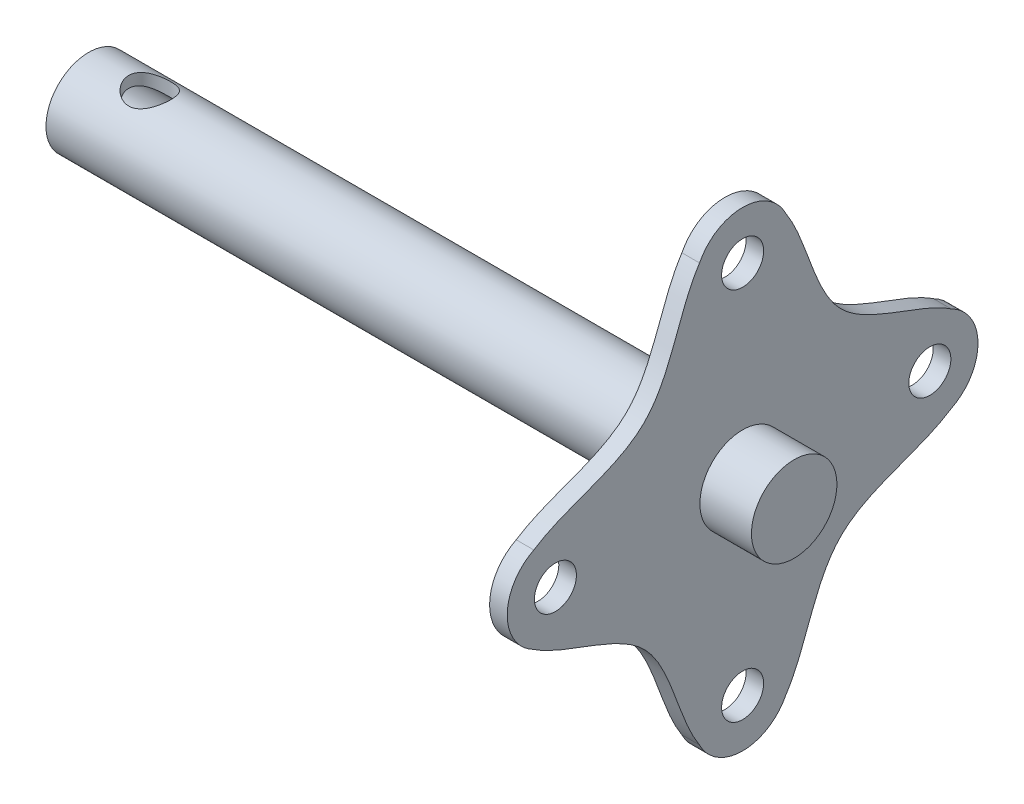
from build123d import *

# Parameters (mm, degrees)
HOLE1_D            = 7.874
HOLE1_DEPTH        = 7.62
SKETCH5_R          = 3.937
CUT_EXTRUDE5_DEPTH = 43.688


with BuildPart() as part:
    # Sketch2 → Revolve1 (revolve)
    with BuildSketch(Plane.XY, mode=Mode.PRIVATE) as revolve1_sk:
        Polygon((-78.74, 8.001), (-78.74, 5.901826446), (-53.34, 5.901826446), (-53.34, 0), (53.34, 0), (53.34, 8.001), (43.688, 8.001), (43.688, 44.069), (40.386, 44.069), (40.386, 8.001), align=None)
    revolve(revolve1_sk.sketch.rotate(Axis((-53.34, 0, 0), (1, 0, 0)), 180), axis=Axis((-53.34, 0, 0), (1, 0, 0)))

    # Hole1
    with Locations(Plane(origin=(-67.31, 8.001, 0), x_dir=(0, 0, 1), z_dir=(0, 1, 0))):
        with Locations((0, 0)):
            Hole(HOLE1_D / 2, depth=HOLE1_DEPTH)

    # Sketch5 → Cut-Extrude5 (cut)
    with BuildSketch(Plane(origin=(0, 0, 0), x_dir=(0, 0, -1), z_dir=(1, 0, 0))):
        with BuildLine():
            ThreePointArc((-8.064098995, 39.086426403), (-4.739613176, 42.72287713), (0, 44.069))
            ThreePointArc((0, 44.069), (-31.16148874, 31.16148874), (-44.069, 0))
            ThreePointArc((-44.069, 0), (-42.72287713, 4.739613176), (-39.086426403, 8.064098995))
            add(Edge.make_bspline(
                [(-39.086426403, 8.064098995), (-32.863680484, 12.182521195), (-14.294768831, 14.295822644), (-12.182274492, 32.864426866), (-8.064098995, 39.086426403)],
                knots=[0, 0, 0, 0, 0.500028123, 1, 1, 1, 1], degree=3))
        make_face()
        with BuildLine():
            ThreePointArc((-44.069, 0), (-31.16148874, -31.16148874), (0, -44.069))
            ThreePointArc((0, -44.069), (-4.739613176, -42.72287713), (-8.064098995, -39.086426403))
            add(Edge.make_bspline(
                [(-8.064098995, -39.086426403), (-12.182485102, -32.863323284), (-14.296876524, -14.294960375), (-32.864680523, -12.182036473), (-39.086426403, -8.064098995)],
                knots=[0, 0, 0, 0, 0.50005114, 1, 1, 1, 1], degree=3))
            ThreePointArc((-39.086426403, -8.064098995), (-42.72287713, -4.739613176), (-44.069, 0))
        make_face()
        with Locations(Location((0, -35.052, 0), (0, 0, 270))):
            Circle(SKETCH5_R)
        with BuildLine():
            ThreePointArc((0, -44.069), (31.16148874, -31.16148874), (44.069, 0))
            ThreePointArc((44.069, 0), (42.72287713, -4.739613176), (39.086426403, -8.064098995))
            add(Edge.make_bspline(
                [(39.086426403, -8.064098995), (32.863323284, -12.182485102), (14.294960375, -14.296876524), (12.182036473, -32.864680523), (8.064098995, -39.086426403)],
                knots=[0, 0, 0, 0, 0.50005114, 1, 1, 1, 1], degree=3))
            ThreePointArc((8.064098995, -39.086426403), (4.739613176, -42.72287713), (0, -44.069))
        make_face()
        with Locations(Location((35.052, 0, 0), (0, 0, 270))):
            Circle(SKETCH5_R)
        with BuildLine():
            ThreePointArc((39.086426403, 8.064098995), (42.72287713, 4.739613176), (44.069, 0))
            ThreePointArc((44.069, 0), (31.16148874, 31.16148874), (0, 44.069))
            ThreePointArc((0, 44.069), (4.739613176, 42.72287713), (8.064098995, 39.086426403))
            add(Edge.make_bspline(
                [(8.064098995, 39.086426403), (12.182485102, 32.863323284), (14.296876524, 14.294960375), (32.864680523, 12.182036473), (39.086426403, 8.064098995)],
                knots=[0, 0, 0, 0, 0.50005114, 1, 1, 1, 1], degree=3))
        make_face()
        with Locations(Location((0, 35.052, 0), (0, 0, 270))):
            Circle(SKETCH5_R)
        with Locations(Location((-35.052, 0, 0), (0, 0, 270))):
            Circle(SKETCH5_R)
    extrude(amount=CUT_EXTRUDE5_DEPTH, mode=Mode.SUBTRACT)


solid = part.part
